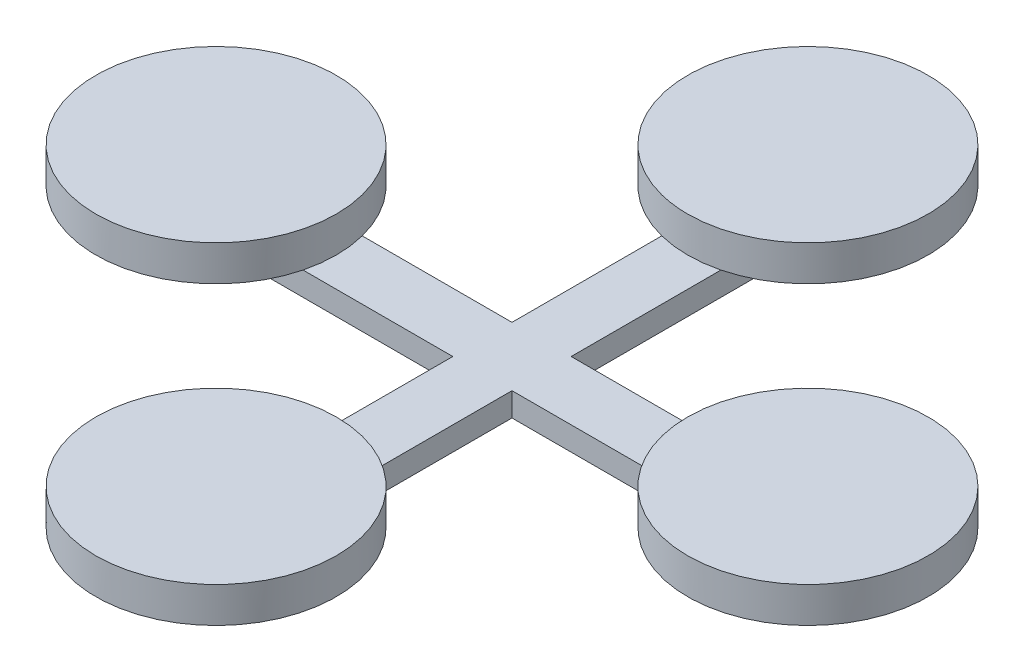
from build123d import *

# Parameters (mm, degrees)
SKETCH1_W           = 25
SKETCH1_H           = 112.5
SKETCH1_H_2         = 25
SKETCH1_W_2         = 112.5
BOSS_EXTRUDE1_DEPTH = 10
SKETCH2_R           = 50.8
BOSS_EXTRUDE2_DEPTH = 15


with BuildPart() as part:
    # Sketch1 → Boss-Extrude1 (new body)
    with BuildSketch(Plane(origin=(0, 0, 0), x_dir=(1, 0, 0), z_dir=(0, 1, 0))):
        with Locations((0, 68.75)):
            Rectangle(SKETCH1_W, SKETCH1_H)
        Rectangle(SKETCH1_W, SKETCH1_H_2)
        with Locations((0, -68.75)):
            Rectangle(SKETCH1_W, SKETCH1_H)
        with Locations((68.75, 0)):
            Rectangle(SKETCH1_W_2, SKETCH1_H_2)
        with Locations((-68.75, 0)):
            Rectangle(SKETCH1_W_2, SKETCH1_H_2)
    extrude(amount=BOSS_EXTRUDE1_DEPTH)

    # Sketch2 → Boss-Extrude2 (add)
    with BuildSketch(Plane(origin=(0, 10, 0), x_dir=(1, 0, 0), z_dir=(0, 1, 0))):
        with Locations(Location((0, 125, 0), (0, 0, 255.755338046))):
            Circle(SKETCH2_R)
        with Locations(Location((125, 0, 0), (0, 0, 165.755338046))):
            Circle(SKETCH2_R)
        with Locations(Location((0, -125, 0), (0, 0, 75.755338046))):
            Circle(SKETCH2_R)
        with Locations(Location((-125, 0, 0), (0, 0, 14.244661954))):
            Circle(SKETCH2_R)
    extrude(amount=BOSS_EXTRUDE2_DEPTH)


solid = part.part
